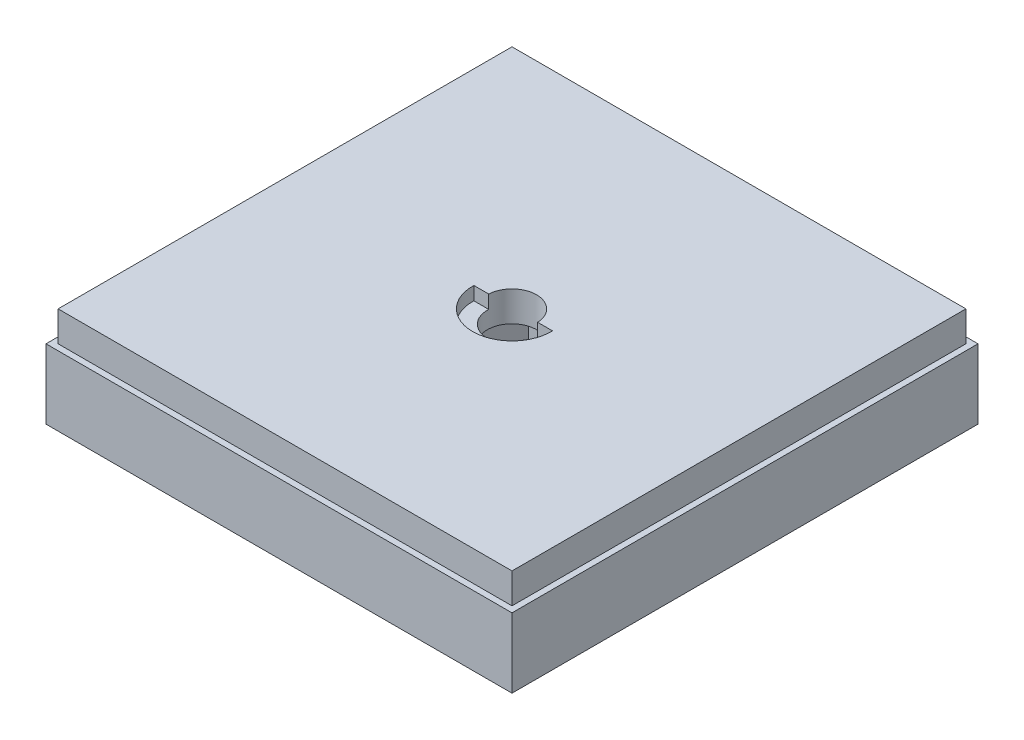
from build123d import *

# Parameters (mm, degrees)
SKETCH1_W           = 77
SKETCH1_H           = 77
BOSS_EXTRUDE1_DEPTH = 11.5
SKETCH2_W           = 75
SKETCH2_H           = 75
SKETCH2_R           = 4.05
BOSS_EXTRUDE2_DEPTH = 5
SKETCH3_R           = 8
CUT_EXTRUDE1_DEPTH  = 7
CUT_EXTRUDE2_DEPTH  = 2.2


with BuildPart() as part:
    # Sketch1 → Boss-Extrude1 (new body)
    with BuildSketch(Plane(origin=(0, 0, 0), x_dir=(1, 0, 0), z_dir=(0, 1, 0))):
        with Locations((-38.5, 38.5)):
            Rectangle(SKETCH1_W, SKETCH1_H)
        Polygon((-30.994446501, 38.5), (-34.74722325, 45), (-42.25277675, 45), (-46.005553499, 38.5), (-42.25277675, 32), (-34.74722325, 32), align=None, mode=Mode.SUBTRACT)
    extrude(amount=BOSS_EXTRUDE1_DEPTH)

    # Sketch2 → Boss-Extrude2 (add)
    with BuildSketch(Plane(origin=(0, 11.5, 0), x_dir=(1, 0, 0), z_dir=(0, 1, 0))):
        with Locations((-38.5, 38.5)):
            Rectangle(SKETCH2_W, SKETCH2_H)
        with Locations(Location((-38.5, 38.5, 0), (0, 0, 270))):
            Circle(SKETCH2_R, mode=Mode.SUBTRACT)
    extrude(amount=BOSS_EXTRUDE2_DEPTH)

    # Sketch3 → Cut-Extrude1 (cut)
    with BuildSketch(Plane.XZ):
        with Locations(Location((-38.5, -38.5, 0), (0, 0, 270))):
            Circle(SKETCH3_R)
    extrude(amount=-CUT_EXTRUDE1_DEPTH, mode=Mode.SUBTRACT)

    # Sketch4 → Cut-Extrude2 (cut)
    with BuildSketch(Plane(origin=(0, 16.5, 0), x_dir=(1, 0, 0), z_dir=(0, 1, 0))):
        with BuildLine():
            Line((-44.996922348, 38.7), (-32.003077652, 38.7))
            ThreePointArc((-32.003077652, 38.7), (-38.5, 32), (-44.996922348, 38.7))
        make_face()
    extrude(amount=-CUT_EXTRUDE2_DEPTH, mode=Mode.SUBTRACT)


solid = part.part
